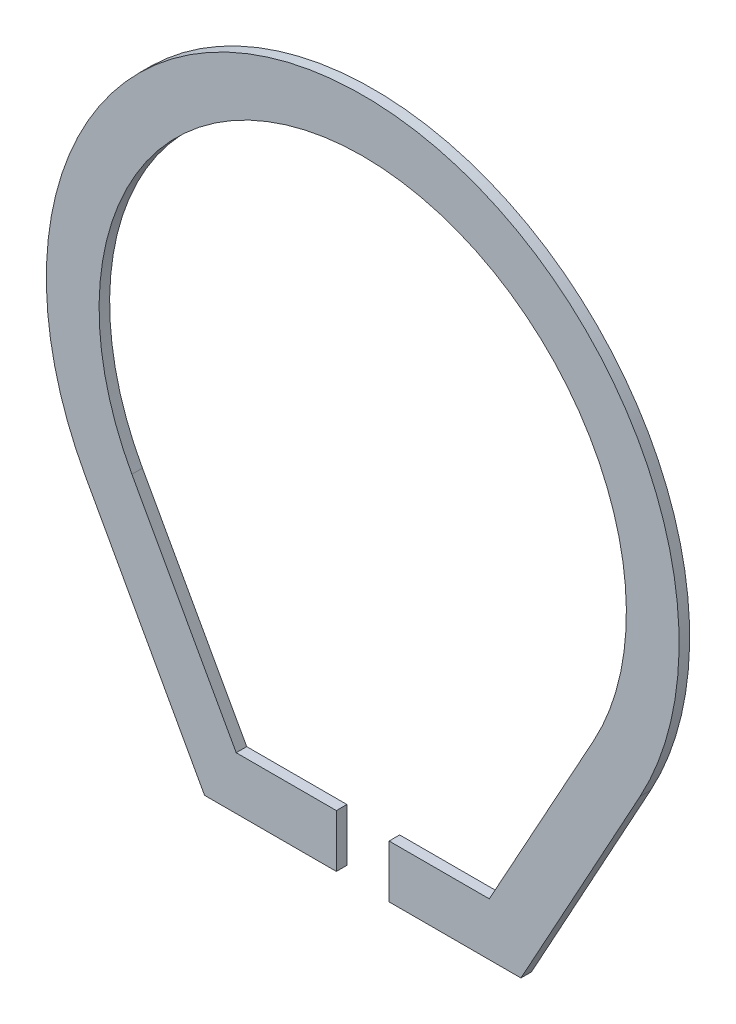
from build123d import *

# Parameters (mm, degrees)
RESSALTO_EXTRUS_O3_DEPTH = 1


with BuildPart() as part:
    # Esboço1 → Ressalto-extrusão3 (new body)
    with BuildSketch(Plane.XY):
        with BuildLine():
            Line((5, -35), (15, -35))
            Line((15, -35), (26.292884648, -14.44590658))
            ThreePointArc((26.292884648, -14.44590658), (0, 30), (-26.292884648, -14.44590658))
            Line((-26.292884648, -14.44590658), (-15, -35))
            Line((-15, -35), (-5, -35))
            Line((-5, -35), (-2.5, -35))
            Line((-2.5, -35), (-2.5, -32.5))
            Line((-2.5, -32.5), (-2.5, -30))
            Line((-2.5, -30), (-5, -30))
            Line((-5, -30), (-12, -30))
            Line((-12, -30), (-21.889001071, -12.077732905))
            ThreePointArc((-21.889001071, -12.077732905), (0, 25), (21.889001071, -12.077732905))
            Line((21.889001071, -12.077732905), (12, -30))
            Line((12, -30), (5, -30))
            Line((5, -30), (2.5, -30))
            Line((2.5, -30), (2.5, -32.5))
            Line((2.5, -32.5), (2.5, -35))
            Line((2.5, -35), (5, -35))
        make_face()
    extrude(amount=RESSALTO_EXTRUS_O3_DEPTH)


solid = part.part
